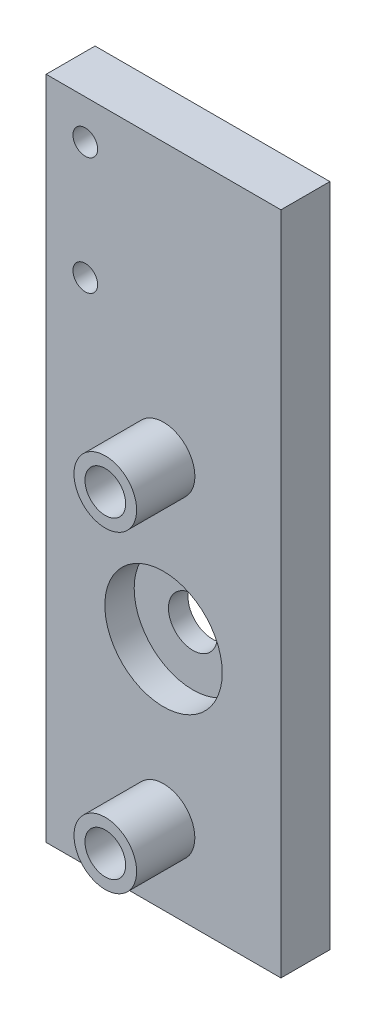
from build123d import *

# Parameters (mm, degrees)
SKETCH1_W           = 38.1
SKETCH1_H           = 76.2
BOSS_EXTRUDE1_DEPTH = 7.9375
SKETCH2_R           = 3.96875
CUT_EXTRUDE1_DEPTH  = 44.330317403
SKETCH4_R           = 9.525
CUT_EXTRUDE2_DEPTH  = 4.7625
SKETCH5_R           = 5.08
BOSS_EXTRUDE2_DEPTH = 9.4488
SKETCH6_R           = 3.302
CUT_EXTRUDE3_DEPTH  = 47.008650575
SKETCH7_W           = 38.1
SKETCH7_H           = 31.75
SKETCH7_R           = 2
BOSS_EXTRUDE4_DEPTH = 7.9375


with BuildPart() as part:
    # Sketch1 → Boss-Extrude1 (new body)
    with BuildSketch(Plane.XY):
        Rectangle(SKETCH1_W, SKETCH1_H)
    extrude(amount=BOSS_EXTRUDE1_DEPTH)

    # Sketch2 → Cut-Extrude1 (cut, through all)
    with BuildSketch(Plane.XY.offset(7.9375)):
        Circle(SKETCH2_R)
    extrude(amount=-CUT_EXTRUDE1_DEPTH, mode=Mode.SUBTRACT)

    # Sketch4 → Cut-Extrude2 (cut)
    with BuildSketch(Plane.XY.offset(7.9375)):
        Circle(SKETCH4_R)
    extrude(amount=-CUT_EXTRUDE2_DEPTH, mode=Mode.SUBTRACT)

    # Sketch5 → Boss-Extrude2 (add)
    with BuildSketch(Plane.XY.offset(7.9375)):
        with Locations(Location((0, 25.4, 0), (0, 0, 180))):
            Circle(SKETCH5_R)
    boss_extrude2 = extrude(amount=BOSS_EXTRUDE2_DEPTH)

    # Sketch6 → Cut-Extrude3 (cut, through all)
    with BuildSketch(Plane.XY.offset(17.3863)):
        with Locations((0, 25.4)):
            Circle(SKETCH6_R)
    cut_extrude3 = extrude(amount=-CUT_EXTRUDE3_DEPTH, mode=Mode.SUBTRACT)

    # Mirror1: Boss-Extrude2, Cut-Extrude3 across plane
    add(boss_extrude2.mirror(Plane.ZX))
    add(cut_extrude3.mirror(Plane.ZX), mode=Mode.SUBTRACT)

    # Sketch7 → Boss-Extrude4 (add)
    with BuildSketch(Plane.XY.offset(7.9375)):
        with Locations((0, 53.975)):
            Rectangle(SKETCH7_W, SKETCH7_H)
        with Locations((-12.7, 63.5)):
            Circle(SKETCH7_R, mode=Mode.SUBTRACT)
        with Locations(Location((-12.7, 44.45, 0), (0, 0, 180))):
            Circle(SKETCH7_R, mode=Mode.SUBTRACT)
    extrude(amount=-BOSS_EXTRUDE4_DEPTH)


solid = part.part
